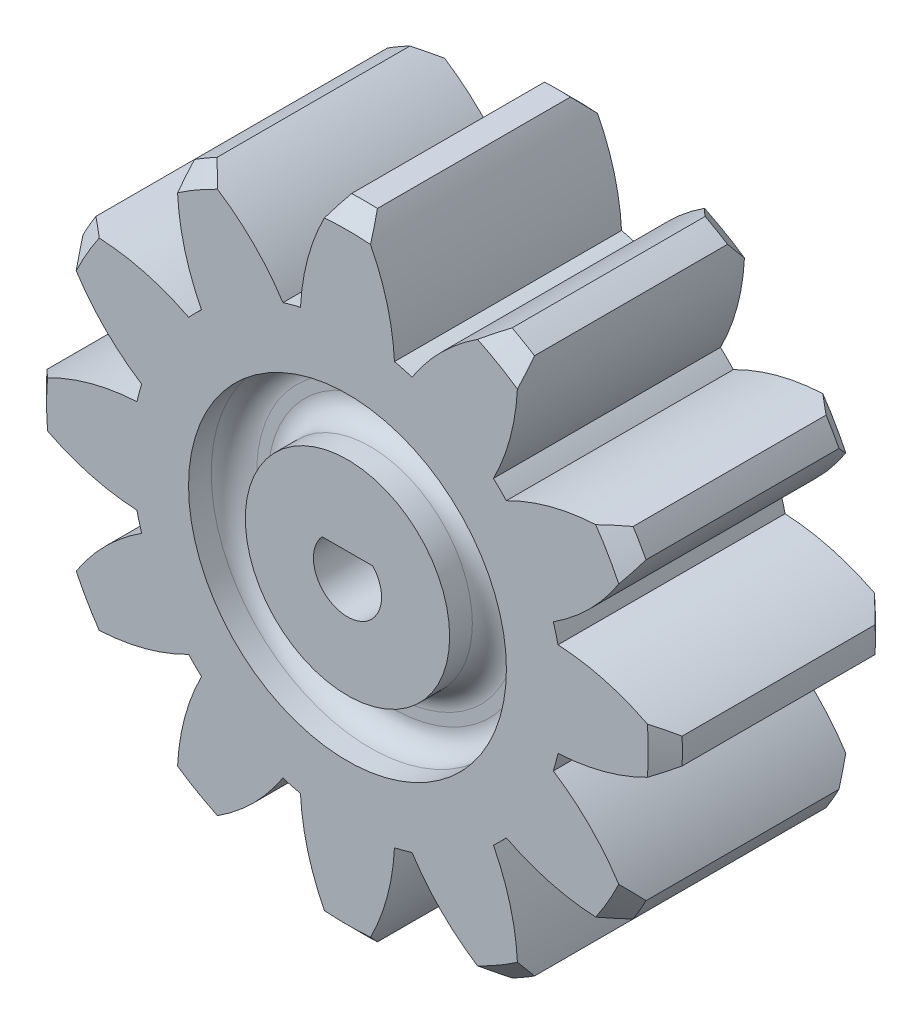
from build123d import *

# Parameters (mm, degrees)
SKETCH1_R                    = 9.5
BOSS_EXTRUDE1_DEPTH          = 10
CHAMFER1_SIZE                = 0.75
CIRPATTERN1_COUNT            = 12
CHAMFER1_OF_CIRPATTERN1_SIZE = 0.75
SKETCH2_R                    = 7
SKETCH2_R_2                  = 4.5
CUT_EXTRUDE1_DEPTH           = 2
FILLET1_R                    = 1
FILLET1_OF_MIRROR1_R         = 1
CUT_EXTRUDE2_REACH           = 24.181


with BuildPart() as part:
    # Sketch1 → Boss-Extrude1 (new body)
    with BuildSketch(Plane.XY):
        Circle(SKETCH1_R)
        with BuildLine():
            ThreePointArc((-2.07, 9.271736623), (0, 9.5), (2.07, 9.271736623))
            ThreePointArc((2.07, 9.271736623), (1.625653209, 11.72726856), (0.57, 13.988391616))
            ThreePointArc((0.57, 13.988391616), (0, 14), (-0.57, 13.988391616))
            ThreePointArc((-0.57, 13.988391616), (-1.625653209, 11.72726856), (-2.07, 9.271736623))
        make_face()
    boss_extrude1 = extrude(amount=BOSS_EXTRUDE1_DEPTH)

    # Chamfer1
    chamfer1_edges = [part.edges().sort_by_distance(p)[0] for p in [
        (0, 14, 10),
        (0, 14, 0),
    ]]
    chamfer(chamfer1_edges, length=CHAMFER1_SIZE)

    # CirPattern1: Boss-Extrude1 ×12 about axis
    cirpattern1_axis = Axis((0, 0, 0), (0, 0, 1))
    for i in range(1, CIRPATTERN1_COUNT):
        add(boss_extrude1.rotate(cirpattern1_axis, i * 360 / CIRPATTERN1_COUNT))

    # Chamfer1 of CirPattern1
    chamfer1_of_cirpattern1_edges = [part.edges().sort_by_distance(p)[0] for p in [
        (-7, 12.124355653, 10),
        (-7, 12.124355653, 0),
        (-12.124355653, 7, 10),
        (-12.124355653, 7, 0),
        (-14, 0, 10),
        (-14, 0, 0),
        (-12.124355653, -7, 10),
        (-12.124355653, -7, 0),
        (-7, -12.124355653, 10),
        (-7, -12.124355653, 0),
        (0, -14, 10),
        (0, -14, 0),
        (7, -12.124355653, 10),
        (7, -12.124355653, 0),
        (12.124355653, -7, 10),
        (12.124355653, -7, 0),
        (14, 0, 10),
        (14, 0, 0),
        (12.124355653, 7, 10),
        (12.124355653, 7, 0),
        (7, 12.124355653, 10),
        (7, 12.124355653, 0),
    ]]
    chamfer(chamfer1_of_cirpattern1_edges, length=CHAMFER1_OF_CIRPATTERN1_SIZE)

    # Sketch2 → Cut-Extrude1 (cut)
    with BuildSketch(Plane.XY.offset(10)):
        Circle(SKETCH2_R)
        Circle(SKETCH2_R_2, mode=Mode.SUBTRACT)
    cut_extrude1 = extrude(amount=-CUT_EXTRUDE1_DEPTH, mode=Mode.SUBTRACT)

    # Fillet1
    fillet1_edges = [part.edges().sort_by_distance(p)[0] for p in [
        (-7, 0, 8),
        (-4.5, 0, 8),
    ]]
    fillet(fillet1_edges, radius=FILLET1_R)

    # Mirror1: Cut-Extrude1 across plane
    add(cut_extrude1.mirror(Plane.XY.offset(5)), mode=Mode.SUBTRACT)

    # Fillet1 of Mirror1
    fillet1_of_mirror1_edges = [part.edges().sort_by_distance(p)[0] for p in [
        (-7, 0, 2),
        (-4.5, 0, 2),
    ]]
    fillet(fillet1_of_mirror1_edges, radius=FILLET1_OF_MIRROR1_R)

    # Sketch3 → Cut-Extrude2 (cut, up to next)
    with BuildSketch(Plane.XY.offset(10), mode=Mode.PRIVATE) as cut_extrude2_sk1:
        with BuildLine():
            Line((1.118033989, 1), (-1.118033989, 1))
            ThreePointArc((-1.118033989, 1), (-0.535233135, -1.401258538), (1.5, 0))
            ThreePointArc((1.5, 0), (1.401258538, 0.535233135), (1.118033989, 1))
        make_face()
    cut_extrude2_tool1 = extrude(cut_extrude2_sk1.sketch, amount=-CUT_EXTRUDE2_REACH, mode=Mode.PRIVATE) & part.part
    add(cut_extrude2_tool1.solids().sort_by_distance((0, -0.148024, 10))[0], mode=Mode.SUBTRACT)


solid = part.part
